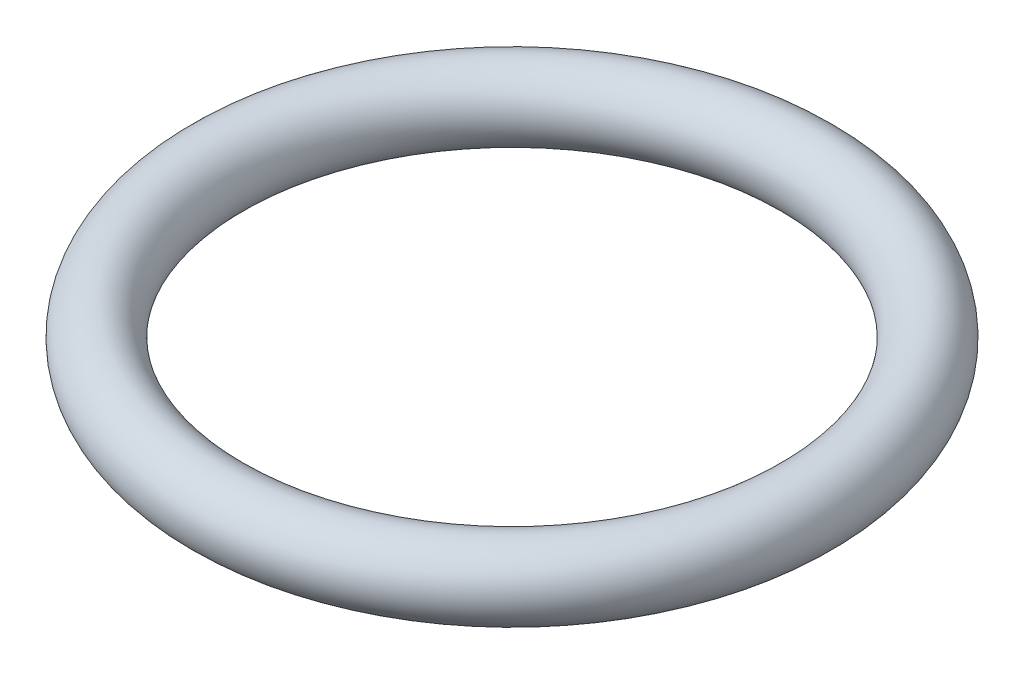
from build123d import *

# Parameters (mm, degrees)
RECONSTRUCTED_NOMINAL_AXIAL_PROFILE_R = 1


with BuildPart() as part:
    # Reconstructed nominal axial profile → Native revolved geometry (revolve)
    with BuildSketch(Plane.XY, mode=Mode.PRIVATE) as native_revolved_geometry_sk:
        with Locations((8.25, 0)):
            Circle(RECONSTRUCTED_NOMINAL_AXIAL_PROFILE_R)
    revolve(native_revolved_geometry_sk.sketch.rotate(Axis((0, -500, 0), (0, 1, 0)), 90), axis=Axis((0, -500, 0), (0, 1, 0)))


solid = part.part
